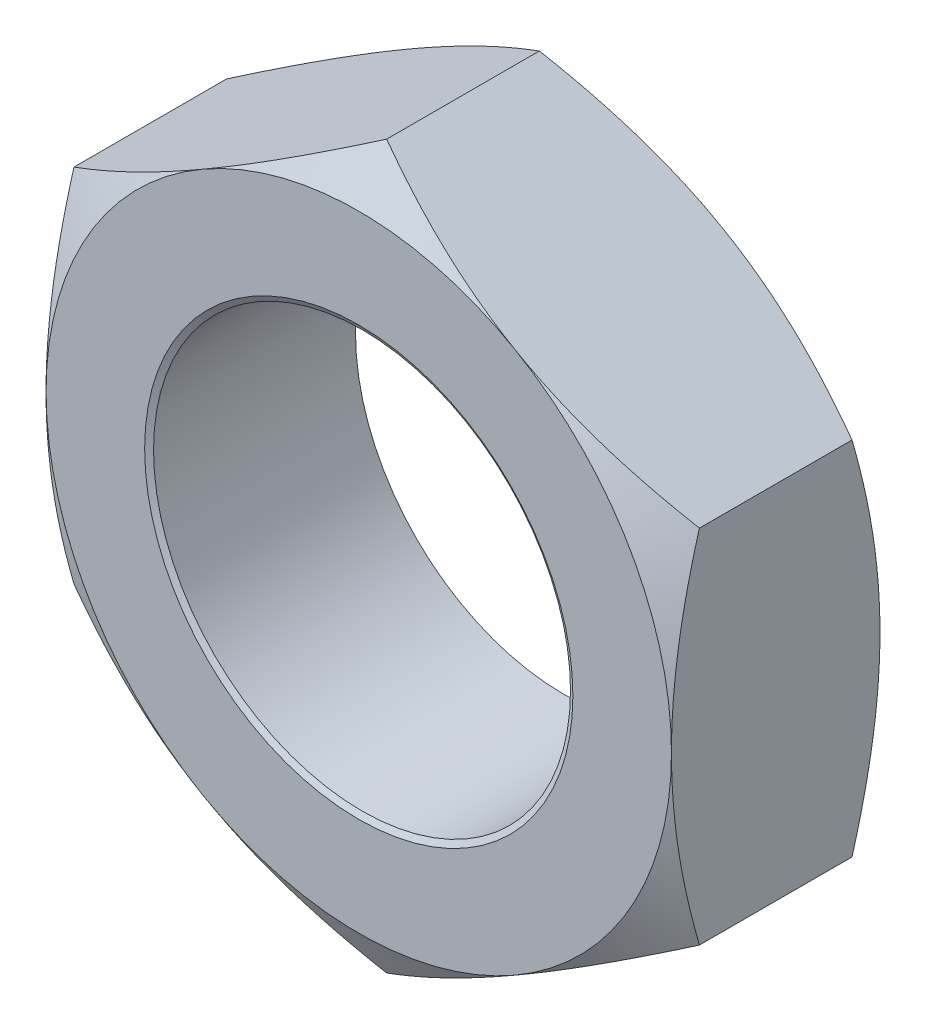
from build123d import *

# Parameters (mm, degrees)
SKETCH3_R                    = 8
BOSS_EXTRUDE1_DEPTH          = 4
SKETCH4_OUTSIDE_W            = 68.146
SKETCH4_OUTSIDE_H            = 71.858
SKETCH4_OUTSIDE_R            = 12
CUT_EXTRUDE1_DEPTH           = 10
CUT_EXTRUDE1_DRAFT           = -60
SKETCH4_OUTSIDE_R_2          = 8.216506351
CUT_EXTRUDE1_PROFILE_2_DEPTH = 10
CUT_EXTRUDE1_PROFILE_2_DRAFT = -60
MIRROR1_COPY_1_SKETCH_W      = 68.146
MIRROR1_COPY_1_SKETCH_H      = 71.858
MIRROR1_COPY_1_SKETCH_R      = 12
MIRROR1_COPY_1_DEPTH         = 10
MIRROR1_COPY_1_DRAFT         = -60
MIRROR1_COPY_2_SKETCH_R      = 8.216506351
MIRROR1_COPY_2_DEPTH         = 10
MIRROR1_COPY_2_DRAFT         = -60
MIRROR1_COPY_3_SKETCH_R      = 8.216506351
MIRROR1_COPY_3_DEPTH         = 10
MIRROR1_COPY_3_DRAFT         = -60


with BuildPart() as part:
    # Sketch3 → Boss-Extrude1 (new, symmetric)
    with BuildSketch(Plane.XY):
        Polygon((-12, 6.92820323), (-12, -6.92820323), (0, -13.856406461), (12, -6.92820323), (12, 6.92820323), (0, 13.856406461), align=None)
        Circle(SKETCH3_R, mode=Mode.SUBTRACT)
    extrude(amount=BOSS_EXTRUDE1_DEPTH, both=True)


with BuildPart() as cut_extrude1_tool:
    # Sketch4 outside → Cut-Extrude1 (with draft: the straight prism first)
    with BuildSketch(Plane.XY.offset(4)):
        Rectangle(SKETCH4_OUTSIDE_W, SKETCH4_OUTSIDE_H)
        Circle(SKETCH4_OUTSIDE_R, mode=Mode.SUBTRACT)
    extrude(amount=-CUT_EXTRUDE1_DEPTH)
    # Cut-Extrude1: the draft: its side faces are tilted about the plane it starts from
    cut_extrude1_sides = [cut_extrude1_tool.faces().sort_by_distance(p)[0] for p in [
        (0, -35.929, -1),
        (34.073, 0, -1),
        (0, 35.929, -1),
        (-34.073, 0, -1),
        (-12, 0, -1),
    ]]
    draft(cut_extrude1_sides, Plane.XY.offset(4), CUT_EXTRUDE1_DRAFT)


with BuildPart() as part_1:
    add(part.part)

    # Cut-Extrude1: cut by cut_extrude1_tool
    add(cut_extrude1_tool.part, mode=Mode.SUBTRACT)


with BuildPart() as cut_extrude1_profile_2_tool:
    # Sketch4 outside → Cut-Extrude1 profile 2 (with draft: the straight prism first)
    with BuildSketch(Plane.XY.offset(4)):
        Circle(SKETCH4_OUTSIDE_R_2)
    extrude(amount=-CUT_EXTRUDE1_PROFILE_2_DEPTH)
    # Cut-Extrude1 profile 2: the draft: its side faces are tilted about the plane it starts from
    cut_extrude1_profile_2_sides = [cut_extrude1_profile_2_tool.faces().sort_by_distance(p)[0] for p in [
        (-8.216506351, 0, -1),
    ]]
    draft(cut_extrude1_profile_2_sides, Plane.XY.offset(4), CUT_EXTRUDE1_PROFILE_2_DRAFT)


with BuildPart() as part_2:
    add(part_1.part)

    # Cut-Extrude1 profile 2: cut by cut_extrude1_profile_2_tool
    add(cut_extrude1_profile_2_tool.part, mode=Mode.SUBTRACT)


with BuildPart() as mirror1_copy_1_tool:
    # Mirror1 copy 1 sketch → Mirror1 copy 1 (with draft: the straight prism first)
    with BuildSketch(Plane(origin=(0, 0, -4), x_dir=(1, 0, 0), z_dir=(0, 0, -1))):
        Rectangle(MIRROR1_COPY_1_SKETCH_W, MIRROR1_COPY_1_SKETCH_H)
        Circle(MIRROR1_COPY_1_SKETCH_R, mode=Mode.SUBTRACT)
    extrude(amount=-MIRROR1_COPY_1_DEPTH)
    # Mirror1 copy 1: the draft: its side faces are tilted about the plane it starts from
    mirror1_copy_1_sides = [mirror1_copy_1_tool.faces().sort_by_distance(p)[0] for p in [
        (0, -35.929, 1),
        (34.073, 0, 1),
        (0, 35.929, 1),
        (-34.073, 0, 1),
        (-12, 0, 1),
    ]]
    draft(mirror1_copy_1_sides, Plane(origin=(0, 0, -4), x_dir=(1, 0, 0), z_dir=(0, 0, -1)), MIRROR1_COPY_1_DRAFT)


with BuildPart() as part_3:
    add(part_2.part)

    # Mirror1 copy 1: cut by mirror1_copy_1_tool
    add(mirror1_copy_1_tool.part, mode=Mode.SUBTRACT)


with BuildPart() as mirror1_copy_2_tool:
    # Mirror1 copy 2 sketch → Mirror1 copy 2 (with draft: the straight prism first)
    with BuildSketch(Plane(origin=(0, 0, -4), x_dir=(1, 0, 0), z_dir=(0, 0, -1))):
        Circle(MIRROR1_COPY_2_SKETCH_R)
    extrude(amount=-MIRROR1_COPY_2_DEPTH)
    # Mirror1 copy 2: the draft: its side faces are tilted about the plane it starts from
    mirror1_copy_2_sides = [mirror1_copy_2_tool.faces().sort_by_distance(p)[0] for p in [
        (-8.216506351, 0, 1),
    ]]
    draft(mirror1_copy_2_sides, Plane(origin=(0, 0, -4), x_dir=(1, 0, 0), z_dir=(0, 0, -1)), MIRROR1_COPY_2_DRAFT)


with BuildPart() as part_4:
    add(part_3.part)

    # Mirror1 copy 2: cut by mirror1_copy_2_tool
    add(mirror1_copy_2_tool.part, mode=Mode.SUBTRACT)


with BuildPart() as mirror1_copy_3_tool:
    # Mirror1 copy 3 sketch → Mirror1 copy 3 (with draft: the straight prism first)
    with BuildSketch(Plane(origin=(0, 0, -4), x_dir=(1, 0, 0), z_dir=(0, 0, -1))):
        Circle(MIRROR1_COPY_3_SKETCH_R)
    extrude(amount=-MIRROR1_COPY_3_DEPTH)
    # Mirror1 copy 3: the draft: its side faces are tilted about the plane it starts from
    mirror1_copy_3_sides = [mirror1_copy_3_tool.faces().sort_by_distance(p)[0] for p in [
        (-8.216506351, 0, 1),
    ]]
    draft(mirror1_copy_3_sides, Plane(origin=(0, 0, -4), x_dir=(1, 0, 0), z_dir=(0, 0, -1)), MIRROR1_COPY_3_DRAFT)


with BuildPart() as part_5:
    add(part_4.part)

    # Mirror1 copy 3: cut by mirror1_copy_3_tool
    add(mirror1_copy_3_tool.part, mode=Mode.SUBTRACT)


solid = part_5.part
